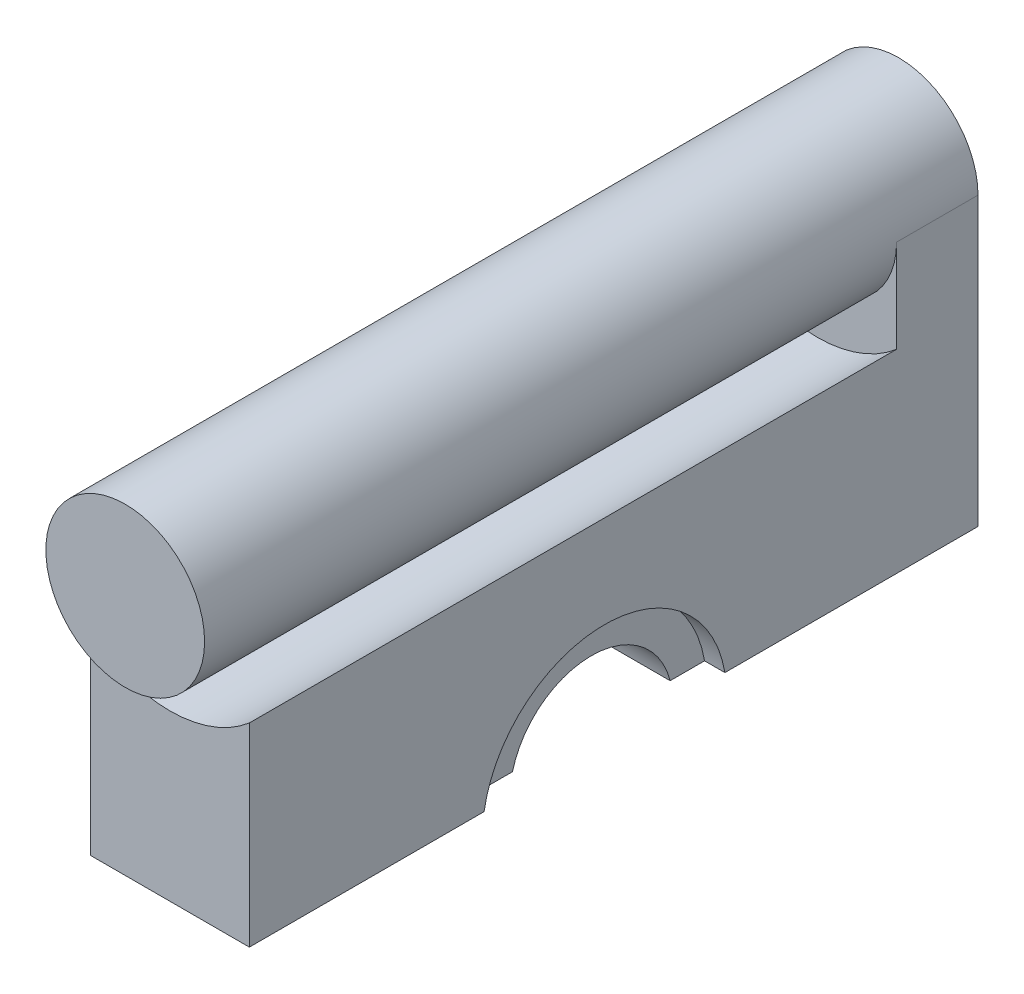
from build123d import *

# Parameters (mm, degrees)
SKETCH_1_R          = 1.95
EXTRUDE_1_DEPTH     = 19
SKETCH_4_W          = 2
SKETCH_4_H          = 9
EXTRUDE_2_DEPTH     = 1.95
CUT_EXTRUDE_1_DEPTH = 21.359396
EXTRUDE_4_DEPTH     = 15.9
SKETCH_9_R          = 2
CUT_EXTRUDE_2_DEPTH = 17
SKETCH_11_R         = 3
CUT_EXTRUDE_4_DEPTH = 0.5


with BuildPart() as part:
    # 스케치1 → 보스-돌출1 (new body)
    with BuildSketch(Plane.XY):
        Circle(SKETCH_1_R)
    extrude(amount=EXTRUDE_1_DEPTH)

    # 스케치4 → 보스-돌출2 (add, symmetric)
    with BuildSketch(Plane(origin=(0, 0, 0), x_dir=(0, 0, -1), z_dir=(1, 0, 0))):
        with Locations((-1, -2.55)):
            Rectangle(SKETCH_4_W, SKETCH_4_H)
    extrude(amount=EXTRUDE_2_DEPTH, both=True)

    # 스케치5 → 컷-돌출1 (cut, through all)
    with BuildSketch(Plane.XY.offset(19)):
        with BuildLine():
            Line((-1.95, 1.95), (-1.95, 0))
            ThreePointArc((-1.95, 0), (-1.378858, 1.378858), (0, 1.95))
            Line((0, 1.95), (-1.95, 1.95))
        make_face()
        with BuildLine():
            ThreePointArc((0, 1.95), (1.378858, 1.378858), (1.95, 0))
            Line((1.95, 0), (1.95, 1.95))
            Line((1.95, 1.95), (0, 1.95))
        make_face()
    extrude(amount=-CUT_EXTRUDE_1_DEPTH, mode=Mode.SUBTRACT)

    # 스케치8 → 보스-돌출4 (add)
    with BuildSketch(Plane.XY.offset(2)):
        with BuildLine():
            ThreePointArc((1.95, -2.279803), (0, -3), (-1.95, -2.279803))
            Line((-1.95, -2.279803), (-1.95, -7.05))
            Line((-1.95, -7.05), (1.95, -7.05))
            Line((1.95, -7.05), (1.95, -2.279803))
        make_face()
    extrude(amount=EXTRUDE_4_DEPTH)

    # 스케치9 → 컷-돌출2 (cut)
    with BuildSketch(Plane.ZY.offset(1.95)):
        with Locations((9, -7.55)):
            Circle(SKETCH_9_R)
    extrude(amount=-CUT_EXTRUDE_2_DEPTH, mode=Mode.SUBTRACT)

    # 스케치11 → 컷-돌출4 (cut)
    with BuildSketch(Plane(origin=(1.95, 0, 0), x_dir=(0, 0, -1), z_dir=(1, 0, 0))):
        with Locations((-9.176059, -7.55)):
            Circle(SKETCH_11_R)
    extrude(amount=-CUT_EXTRUDE_4_DEPTH, mode=Mode.SUBTRACT)


solid = part.part
